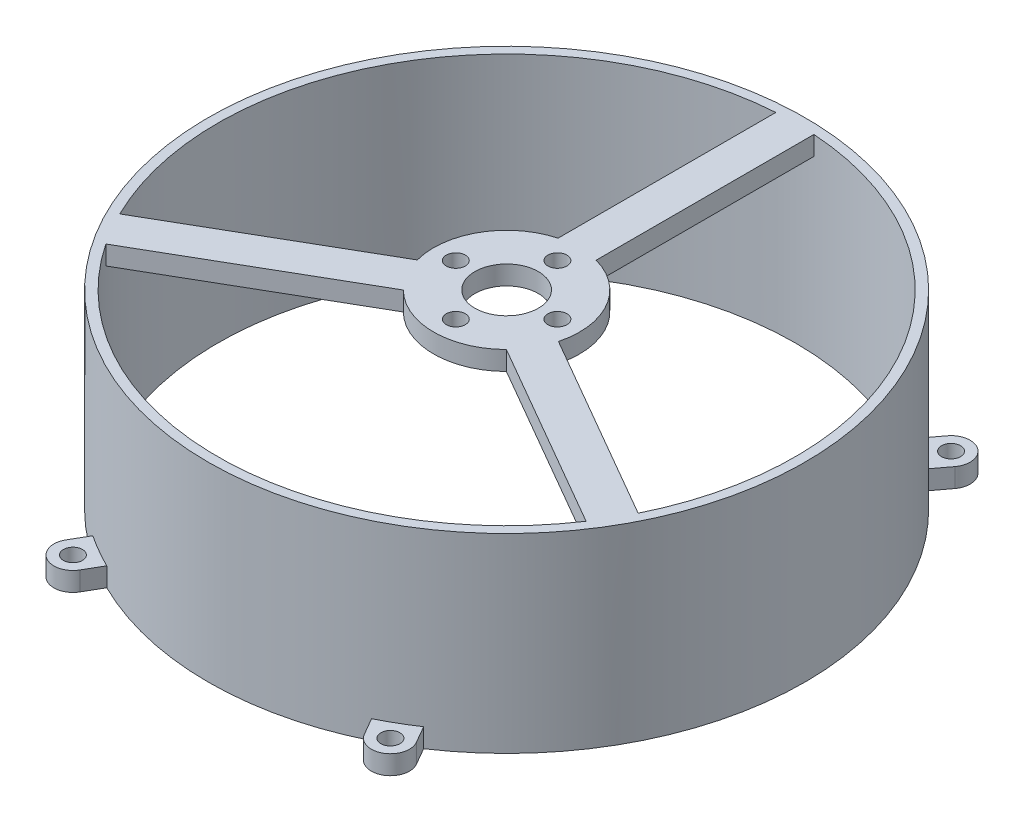
from build123d import *
from build123d.topology import SkipClean

# Parameters (mm, degrees)
SKETCH_1_R          = 47
SKETCH_1_R_2        = 45
EXTRUDE_1_DEPTH     = 30
SKETCH_2_R          = 1.5
EXTRUDE_5_DEPTH     = 3
EXTRUDE_START       = -3
SKETCH_3_R          = 5
SKETCH_3_R_2        = 1.5
EXTRUDE_6_DEPTH     = 3
CUT_EXTRUDE_1_DEPTH = 30
CUT_EXTRUDE_START   = 44
SKETCH_5_R          = 45.5
CUT_EXTRUDE_2_DEPTH = 44


with BuildPart() as part:
    # 草图1 → 凸台-拉伸1 (new body)
    with BuildSketch(Plane(origin=(0, 0, 0), x_dir=(1, 0, 0), z_dir=(0, 1, 0))):
        with Locations(Location((0, 0, 0), (0, 0, 270))):
            Circle(SKETCH_1_R)
        with Locations(Location((0, 0, 0), (0, 0, 270))):
            Circle(SKETCH_1_R_2, mode=Mode.SUBTRACT)
    extrude(amount=EXTRUDE_1_DEPTH)

    # 草图2 → 凸台-拉伸5 (add)
    # profile 1 of 4: a face of its own
    with SkipClean():  # the faces are left unmerged after this step: merging them gives an invalid solid
        with BuildSketch(Plane(origin=(0, 0, 0), x_dir=(-1, 0, 0), z_dir=(0, -1, 0))):
            with BuildLine():
                Line((22.401923789, -44.801270189), (19.851868109, -40.38444419))
                ThreePointArc((19.851868109, -40.38444419), (22.5, -38.97114317), (25.048020532, -37.38444419))
                Line((25.048020532, -37.38444419), (27.598076211, -41.801270189))
                ThreePointArc((27.598076211, -41.801270189), (26.5, -45.899346401), (22.401923789, -44.801270189))
            make_face()
            with Locations(Location((25, -43.301270189, 0), (0, 0, 90))):
                Circle(SKETCH_2_R, mode=Mode.SUBTRACT)
        # profile 2 of 4: a face of its own
        with BuildSketch(Plane(origin=(0, 0, 0), x_dir=(-1, 0, 0), z_dir=(0, -1, 0))):
            with BuildLine():
                Line((-27.598076211, -41.801270189), (-25.048020532, -37.38444419))
                ThreePointArc((-25.048020532, -37.38444419), (-22.5, -38.97114317), (-19.851868109, -40.38444419))
                Line((-19.851868109, -40.38444419), (-22.401923789, -44.801270189))
                ThreePointArc((-22.401923789, -44.801270189), (-26.5, -45.899346401), (-27.598076211, -41.801270189))
            make_face()
            with Locations(Location((-25, -43.301270189, 0), (0, 0, 270))):
                Circle(SKETCH_2_R, mode=Mode.SUBTRACT)
        # profile 3 of 4: a face of its own
        with BuildSketch(Plane(origin=(0, 0, 0), x_dir=(-1, 0, 0), z_dir=(0, -1, 0))):
            with BuildLine():
                Line((32.4, 38.2), (29.339933185, 34.119910913))
                ThreePointArc((29.339933185, 34.119910913), (27, 36), (24.539933185, 37.719910913))
                Line((24.539933185, 37.719910913), (27.6, 41.8))
                ThreePointArc((27.6, 41.8), (31.8, 42.4), (32.4, 38.2))
            make_face()
            with Locations(Location((30, 40, 0), (0, 0, 90))):
                Circle(SKETCH_2_R, mode=Mode.SUBTRACT)
        # profile 4 of 4: a face of its own
        with BuildSketch(Plane(origin=(0, 0, 0), x_dir=(-1, 0, 0), z_dir=(0, -1, 0))):
            with BuildLine():
                Line((-27.6, 41.8), (-24.539933185, 37.719910913))
                ThreePointArc((-24.539933185, 37.719910913), (-27, 36), (-29.339933185, 34.119910913))
                Line((-29.339933185, 34.119910913), (-32.4, 38.2))
                ThreePointArc((-32.4, 38.2), (-31.8, 42.4), (-27.6, 41.8))
            make_face()
            with Locations(Location((-30, 40, 0), (0, 0, 270))):
                Circle(SKETCH_2_R, mode=Mode.SUBTRACT)
        extrude(amount=-EXTRUDE_5_DEPTH)

    # 草图3 → 凸台-拉伸6 (add)
    with SkipClean():  # the faces are left unmerged after this step: merging them gives an invalid solid
        with BuildSketch(Plane(origin=(0, 30, 0), x_dir=(1, 0, 0), z_dir=(0, 1, 0)).offset(EXTRUDE_START)):
            with BuildLine():
                Line((-3, 44.899888641), (-3, 11.101801656))
                ThreePointArc((-3, 11.101801656), (-9.959292144, 5.75), (-11.114442262, -2.952824616))
                Line((-11.114442262, -2.952824616), (-40.38444419, -19.851868109))
                ThreePointArc((-40.38444419, -19.851868109), (-38.97114317, -22.5), (-37.38444419, -25.048020532))
                Line((-37.38444419, -25.048020532), (-8.114442262, -8.148977039))
                ThreePointArc((-8.114442262, -8.148977039), (0, -11.5), (8.114442262, -8.148977039))
                Line((8.114442262, -8.148977039), (37.38444419, -25.048020532))
                ThreePointArc((37.38444419, -25.048020532), (38.97114317, -22.5), (40.38444419, -19.851868109))
                Line((40.38444419, -19.851868109), (11.114442262, -2.952824616))
                ThreePointArc((11.114442262, -2.952824616), (9.959292144, 5.75), (3, 11.101801656))
                Line((3, 11.101801656), (3, 44.899888641))
                ThreePointArc((3, 44.899888641), (0, 45), (-3, 44.899888641))
            make_face()
            with Locations(Location((0, 0, 0), (0, 0, 270))):
                Circle(SKETCH_3_R, mode=Mode.SUBTRACT)
            with Locations(Location((8, 0, 0), (0, 0, 270))):
                Circle(SKETCH_3_R_2, mode=Mode.SUBTRACT)
            with Locations(Location((0, -8, 0), (0, 0, 270))):
                Circle(SKETCH_3_R_2, mode=Mode.SUBTRACT)
            with Locations(Location((-8, 0, 0), (0, 0, 270))):
                Circle(SKETCH_3_R_2, mode=Mode.SUBTRACT)
            with Locations(Location((0, 8, 0), (0, 0, 270))):
                Circle(SKETCH_3_R_2, mode=Mode.SUBTRACT)
        extrude(amount=EXTRUDE_6_DEPTH)

    # 草图4 → 切除-拉伸1 (cut)
    with BuildSketch(Plane.XZ):
        with BuildLine():
            Line((-37.38444419, 25.048020532), (-37.818411718, 25.298571801))
            ThreePointArc((-37.818411718, 25.298571801), (0, 45.5), (37.818411718, 25.298571801))
            Line((37.818411718, 25.298571801), (37.38444419, 25.048020532))
            ThreePointArc((37.38444419, 25.048020532), (0, 45), (-37.38444419, 25.048020532))
        make_face()
        with BuildLine():
            Line((-40.38444419, 19.851868109), (-40.818411718, 20.102419378))
            ThreePointArc((-40.818411718, 20.102419378), (-39.404155872, -22.75), (-3, -45.400991179))
            Line((-3, -45.400991179), (-3, -44.899888641))
            ThreePointArc((-3, -44.899888641), (-38.97114317, -22.5), (-40.38444419, 19.851868109))
        make_face()
        with BuildLine():
            Line((40.38444419, 19.851868109), (40.818411718, 20.102419378))
            ThreePointArc((40.818411718, 20.102419378), (39.404155872, -22.75), (3, -45.400991179))
            Line((3, -45.400991179), (3, -44.899888641))
            ThreePointArc((3, -44.899888641), (38.97114317, -22.5), (40.38444419, 19.851868109))
        make_face()
    extrude(amount=-CUT_EXTRUDE_1_DEPTH, mode=Mode.SUBTRACT)

    # 草图5 → 切除-拉伸2 (cut)
    with SkipClean():  # the faces are left unmerged after this step: merging them gives an invalid solid
        with BuildSketch(Plane(origin=(0, 27, 0), x_dir=(-1, 0, 0), z_dir=(0, -1, 0)).offset(CUT_EXTRUDE_START)):
            with Locations(Location((0, 0, 0), (0, 0, 90))):
                Circle(SKETCH_5_R)
        extrude(amount=-CUT_EXTRUDE_2_DEPTH, mode=Mode.SUBTRACT)


solid = part.part
